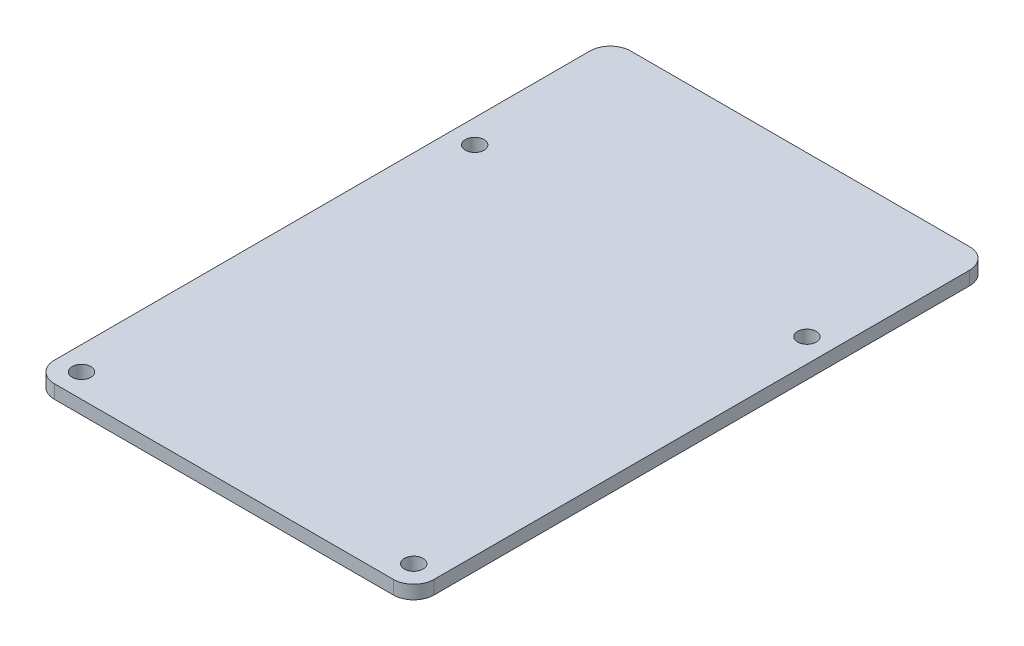
from build123d import *

# Parameters (mm, degrees)
SKETCH1_W           = 56
SKETCH1_H           = 85
SKETCH1_R           = 1.375
BOSS_EXTRUDE1_DEPTH = 2
FILLET1_R           = 3


with BuildPart() as part:
    # Sketch1 → Boss-Extrude1 (new body)
    with BuildSketch(Plane(origin=(0, 0, 0), x_dir=(1, 0, 0), z_dir=(0, 1, 0))):
        Rectangle(SKETCH1_W, SKETCH1_H)
        with Locations(Location((-24.5, -39, 0), (0, 0, 270))):
            Circle(SKETCH1_R, mode=Mode.SUBTRACT)
        with Locations(Location((-24.5, 19, 0), (0, 0, 270))):
            Circle(SKETCH1_R, mode=Mode.SUBTRACT)
        with Locations(Location((24.5, 19, 0), (0, 0, 270))):
            Circle(SKETCH1_R, mode=Mode.SUBTRACT)
        with Locations(Location((24.5, -39, 0), (0, 0, 270))):
            Circle(SKETCH1_R, mode=Mode.SUBTRACT)
    extrude(amount=BOSS_EXTRUDE1_DEPTH)

    # Fillet1
    fillet1_edges = [part.edges().sort_by_distance(p)[0] for p in [
        (28, 1, 42.5),
        (-28, 1, 42.5),
        (-28, 1, -42.5),
        (28, 1, -42.5),
    ]]
    fillet(fillet1_edges, radius=FILLET1_R)


solid = part.part
